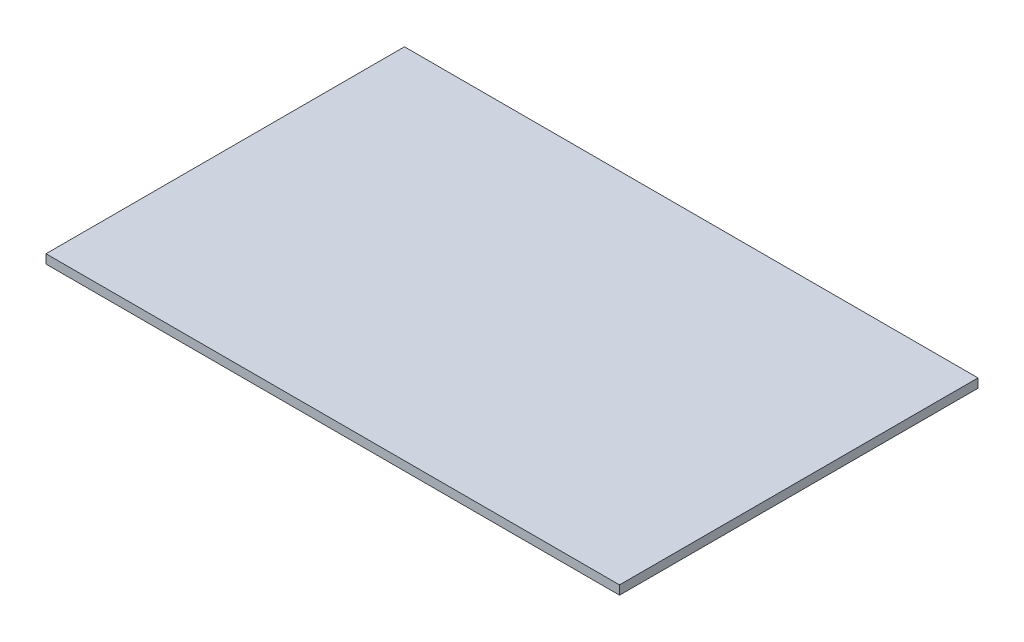
from build123d import *

# Parameters (mm, degrees)
SKETCH1_W           = 406.4
SKETCH1_H           = 254
BOSS_EXTRUDE1_DEPTH = 6.35


with BuildPart() as part:
    # Sketch1 → Boss-Extrude1 (new body)
    with BuildSketch(Plane(origin=(0, 0, 0), x_dir=(1, 0, 0), z_dir=(0, 1, 0))):
        with Locations((-203.2, 127)):
            Rectangle(SKETCH1_W, SKETCH1_H)
    extrude(amount=BOSS_EXTRUDE1_DEPTH)


solid = part.part
